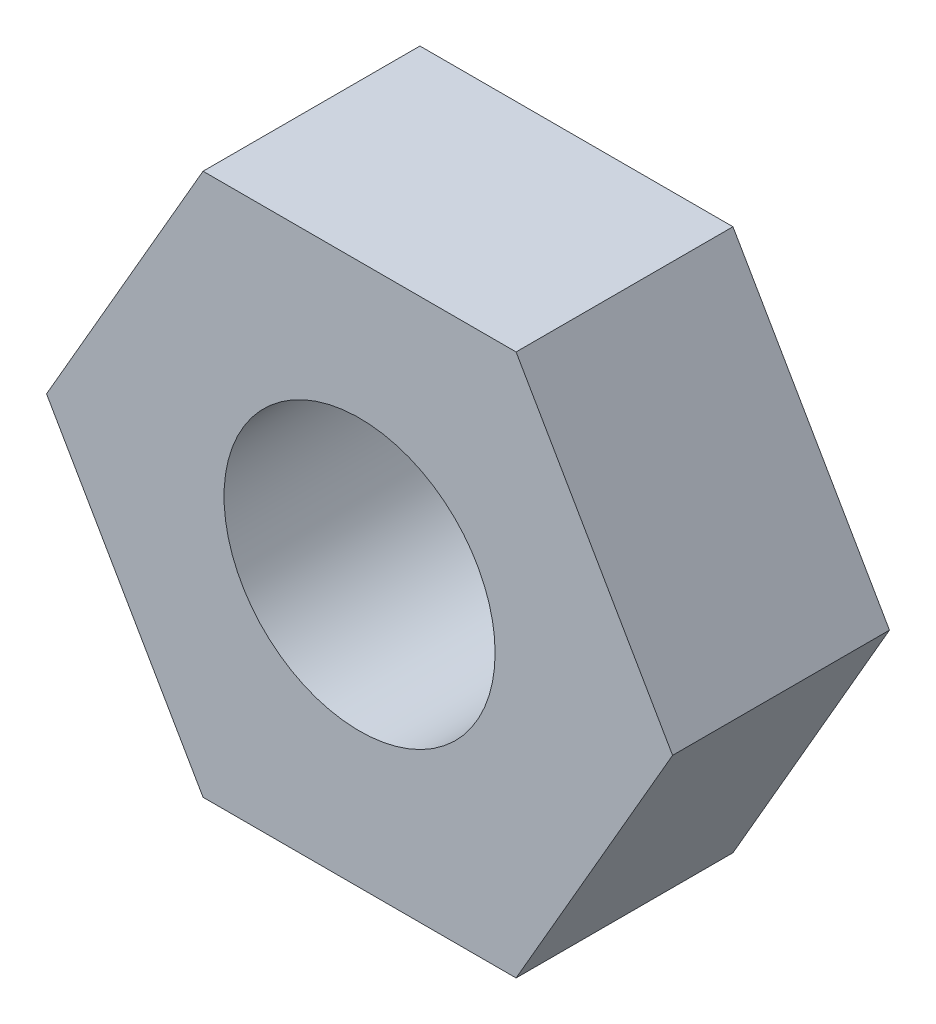
from build123d import *

# Parameters (mm, degrees)
SKETCH1_R          = 1.25
NUT_ENVELOPE_DEPTH = 2


with BuildPart() as part:
    # Sketch1 → Nut_Envelope (new body)
    with BuildSketch(Plane.XY):
        Polygon((2.886751346, 0), (1.443375673, 2.5), (-1.443375673, 2.5), (-2.886751346, 0), (-1.443375673, -2.5), (1.443375673, -2.5), align=None)
        Circle(SKETCH1_R, mode=Mode.SUBTRACT)
    extrude(amount=NUT_ENVELOPE_DEPTH)


solid = part.part
